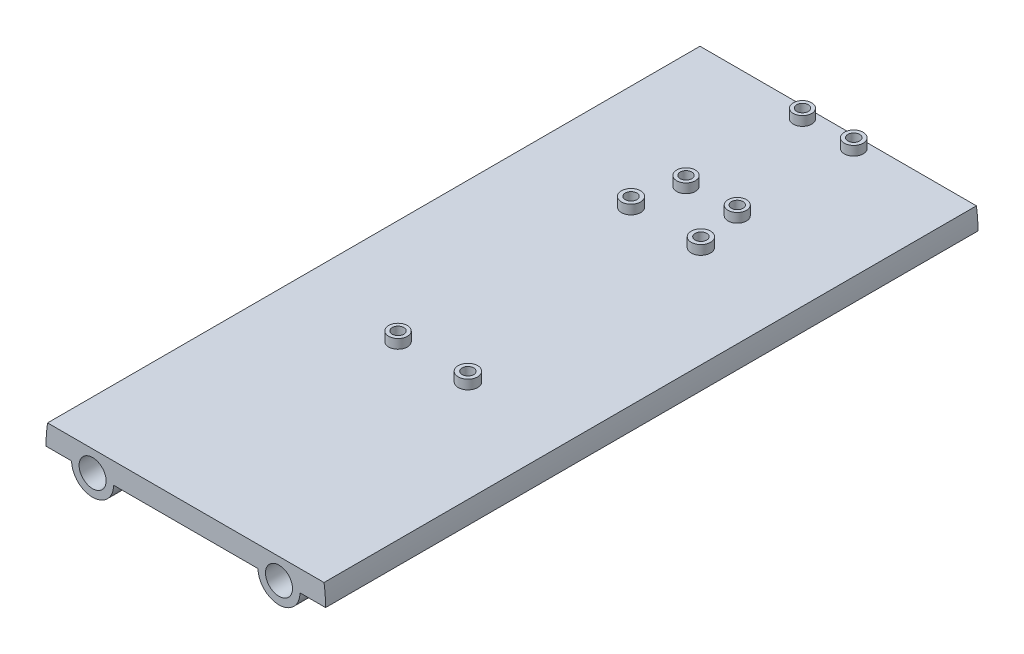
from build123d import *

# Parameters (mm, degrees)
SKETCH1_R           = 5.715
SKETCH1_R_2         = 3.683
BOSS_EXTRUDE2_DEPTH = 177.8
SKETCH2_R           = 1.5875
CUT_EXTRUDE1_DEPTH  = 183.195210969
BOSS_EXTRUDE4_START = 2.54
SKETCH3_R           = 2.521654131
SKETCH3_R_2         = 1.5875
SKETCH3_R_3         = 2.580622747
SKETCH3_R_4         = 2.513629008
SKETCH3_R_5         = 2.53806637
BOSS_EXTRUDE4_DEPTH = 2.54
SKETCH4_R           = 1.5875
CUT_EXTRUDE2_DEPTH  = 183.195210969
BOSS_EXTRUDE5_START = 2.54
SKETCH5_R           = 2.618871397
SKETCH5_R_2         = 1.5875
SKETCH5_R_3         = 2.639509757
SKETCH5_R_4         = 2.648115463
SKETCH5_R_5         = 2.550190152
BOSS_EXTRUDE5_DEPTH = 2.54


with BuildPart() as part:
    # Sketch1 → Boss-Extrude2 (new body)
    # profile 1 of 5: a face of its own
    with BuildSketch(Plane.XY):
        with BuildLine():
            Line((25.4, 5.715), (-25.4, 5.715))
            ThreePointArc((-25.4, 5.715), (-21.358884746, 4.041115254), (-19.685, 0))
            Line((-19.685, 0), (19.685, 0))
            ThreePointArc((19.685, 0), (21.358884746, 4.041115254), (25.4, 5.715))
        make_face()
    # profile 2 of 5: a face of its own
    with BuildSketch(Plane.XY):
        with Locations((-25.4, 0)):
            Circle(SKETCH1_R)
        with Locations((-25.4, 0)):
            Circle(SKETCH1_R_2, mode=Mode.SUBTRACT)
    # profile 3 of 5: a face of its own
    with BuildSketch(Plane.XY):
        with Locations((25.4, 0)):
            Circle(SKETCH1_R)
        with Locations((25.4, 0)):
            Circle(SKETCH1_R_2, mode=Mode.SUBTRACT)
    # profile 4 of 5: a face of its own
    with BuildSketch(Plane.XY):
        with BuildLine():
            ThreePointArc((-31.115, 0), (-29.441115254, 4.041115254), (-25.4, 5.715))
            Line((-25.4, 5.715), (-37.668936473, 5.715))
            ThreePointArc((-37.668936473, 5.715), (-37.992081278, 2.865616895), (-38.1, 0))
            Line((-38.1, 0), (-31.115, 0))
        make_face()
    # profile 5 of 5: a face of its own
    with BuildSketch(Plane.XY):
        with BuildLine():
            Line((37.668936473, 5.715), (25.4, 5.715))
            ThreePointArc((25.4, 5.715), (29.441115254, 4.041115254), (31.115, 0))
            Line((31.115, 0), (38.1, 0))
            ThreePointArc((38.1, 0), (37.992081278, 2.865616895), (37.668936473, 5.715))
        make_face()
    extrude(amount=BOSS_EXTRUDE2_DEPTH)

    # Sketch2 → Cut-Extrude1 (cut, through all)
    with BuildSketch(Plane(origin=(0, 5.715, 0), x_dir=(1, 0, 0), z_dir=(0, 1, 0))):
        with Locations(Location((-6.553936473, -3.175, 0), (0, 0, 270))):
            Circle(SKETCH2_R)
        with Locations(Location((7.416063527, -3.175, 0), (0, 0, 270))):
            Circle(SKETCH2_R)
        with Locations(Location((-6.553936473, -34.925, 0), (0, 0, 270))):
            Circle(SKETCH2_R)
        with Locations(Location((7.416063527, -34.925, 0), (0, 0, 270))):
            Circle(SKETCH2_R)
    extrude(amount=-CUT_EXTRUDE1_DEPTH, mode=Mode.SUBTRACT)

    # Sketch3 → Boss-Extrude4 (add)
    # profile 1 of 4: a face of its own
    with BuildSketch(Plane(origin=(0, 5.715, 0), x_dir=(1, 0, 0), z_dir=(0, 1, 0)).offset(BOSS_EXTRUDE4_START)):
        with Locations(Location((-6.553936473, -3.175, 0), (0, 0, 270))):
            Circle(SKETCH3_R)
        with Locations(Location((-6.553936473, -3.175, 0), (0, 0, 270))):
            Circle(SKETCH3_R_2, mode=Mode.SUBTRACT)
    # profile 2 of 4: a face of its own
    with BuildSketch(Plane(origin=(0, 5.715, 0), x_dir=(1, 0, 0), z_dir=(0, 1, 0)).offset(BOSS_EXTRUDE4_START)):
        with Locations(Location((7.416063527, -3.175, 0), (0, 0, 270))):
            Circle(SKETCH3_R_3)
        with Locations(Location((7.416063527, -3.175, 0), (0, 0, 270))):
            Circle(SKETCH3_R_2, mode=Mode.SUBTRACT)
    # profile 3 of 4: a face of its own
    with BuildSketch(Plane(origin=(0, 5.715, 0), x_dir=(1, 0, 0), z_dir=(0, 1, 0)).offset(BOSS_EXTRUDE4_START)):
        with Locations(Location((7.416063527, -34.925, 0), (0, 0, 270))):
            Circle(SKETCH3_R_4)
        with Locations(Location((7.416063527, -34.925, 0), (0, 0, 270))):
            Circle(SKETCH3_R_2, mode=Mode.SUBTRACT)
    # profile 4 of 4: a face of its own
    with BuildSketch(Plane(origin=(0, 5.715, 0), x_dir=(1, 0, 0), z_dir=(0, 1, 0)).offset(BOSS_EXTRUDE4_START)):
        with Locations(Location((-6.553936473, -34.925, 0), (0, 0, 270))):
            Circle(SKETCH3_R_5)
        with Locations(Location((-6.553936473, -34.925, 0), (0, 0, 270))):
            Circle(SKETCH3_R_2, mode=Mode.SUBTRACT)
    extrude(amount=-BOSS_EXTRUDE4_DEPTH)

    # Sketch4 → Cut-Extrude2 (cut, through all)
    with BuildSketch(Plane(origin=(0, 5.715, 0), x_dir=(1, 0, 0), z_dir=(0, 1, 0))):
        with Locations(Location((-9.093936473, -47.368407893, 0), (0, 0, 270))):
            Circle(SKETCH4_R)
        with Locations(Location((9.956063527, -47.368407893, 0), (0, 0, 270))):
            Circle(SKETCH4_R)
        with Locations(Location((9.956063527, -110.868407893, 0), (0, 0, 270))):
            Circle(SKETCH4_R)
        with Locations(Location((-9.093936473, -110.868407893, 0), (0, 0, 270))):
            Circle(SKETCH4_R)
    extrude(amount=-CUT_EXTRUDE2_DEPTH, mode=Mode.SUBTRACT)

    # Sketch5 → Boss-Extrude5 (add)
    # profile 1 of 4: a face of its own
    with BuildSketch(Plane(origin=(0, 5.715, 0), x_dir=(1, 0, 0), z_dir=(0, 1, 0)).offset(BOSS_EXTRUDE5_START)):
        with Locations(Location((-9.093936473, -47.368407893, 0), (0, 0, 270))):
            Circle(SKETCH5_R)
        with Locations(Location((-9.093936473, -47.368407893, 0), (0, 0, 270))):
            Circle(SKETCH5_R_2, mode=Mode.SUBTRACT)
    # profile 2 of 4: a face of its own
    with BuildSketch(Plane(origin=(0, 5.715, 0), x_dir=(1, 0, 0), z_dir=(0, 1, 0)).offset(BOSS_EXTRUDE5_START)):
        with Locations(Location((9.956063527, -47.368407893, 0), (0, 0, 270))):
            Circle(SKETCH5_R_3)
        with Locations(Location((9.956063527, -47.368407893, 0), (0, 0, 270))):
            Circle(SKETCH5_R_2, mode=Mode.SUBTRACT)
    # profile 3 of 4: a face of its own
    with BuildSketch(Plane(origin=(0, 5.715, 0), x_dir=(1, 0, 0), z_dir=(0, 1, 0)).offset(BOSS_EXTRUDE5_START)):
        with Locations(Location((9.956063527, -110.868407893, 0), (0, 0, 270))):
            Circle(SKETCH5_R_4)
        with Locations(Location((9.956063527, -110.868407893, 0), (0, 0, 270))):
            Circle(SKETCH5_R_2, mode=Mode.SUBTRACT)
    # profile 4 of 4: a face of its own
    with BuildSketch(Plane(origin=(0, 5.715, 0), x_dir=(1, 0, 0), z_dir=(0, 1, 0)).offset(BOSS_EXTRUDE5_START)):
        with Locations(Location((-9.093936473, -110.868407893, 0), (0, 0, 270))):
            Circle(SKETCH5_R_5)
        with Locations(Location((-9.093936473, -110.868407893, 0), (0, 0, 270))):
            Circle(SKETCH5_R_2, mode=Mode.SUBTRACT)
    extrude(amount=-BOSS_EXTRUDE5_DEPTH)


solid = part.part
